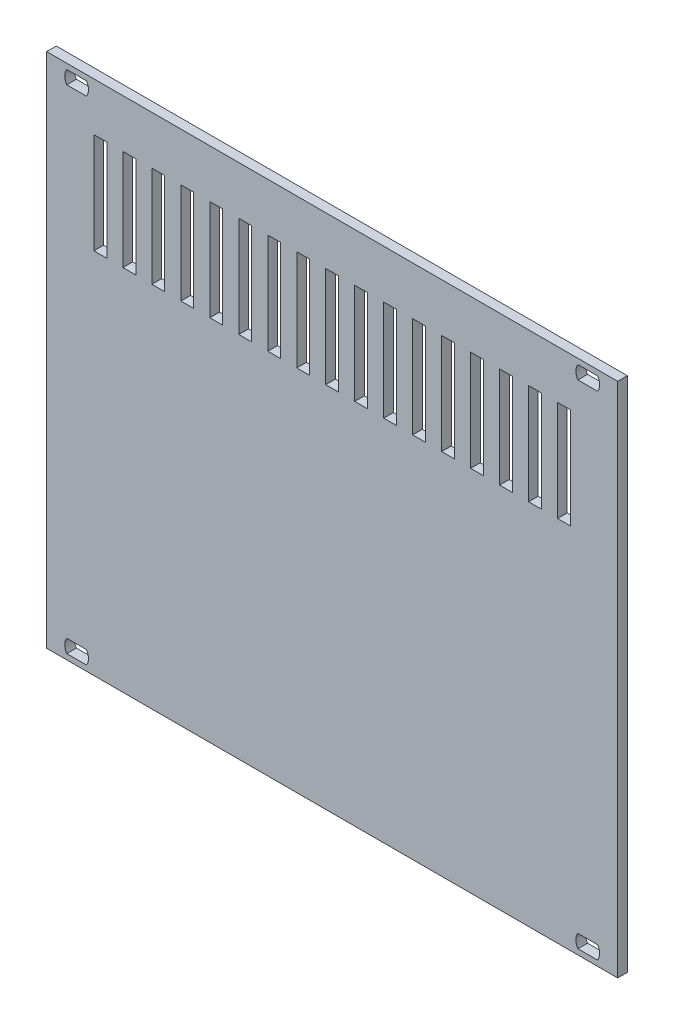
from build123d import *

# Parameters (mm, degrees)
MODEL_W            = 141.9
MODEL_H            = 128.4
MODEL_W_2          = 3.2
MODEL_H_2          = 25
BOSS_EXTRU_1_DEPTH = 2.4


with BuildPart() as part:
    # Model → Boss.-Extru.1 (new body)
    with BuildSketch(Plane.XY):
        with Locations((70.95, 64.2)):
            Rectangle(MODEL_W, MODEL_H)
        with BuildLine():
            Line((9.895405778, 123.750002855), (5.004594222, 123.750002855))
            ThreePointArc((5.004594222, 123.750002855), (4.5, 125.40000351), (5.004598148, 127.050002965))
            Line((5.004598148, 127.050002965), (9.895401852, 127.050002965))
            ThreePointArc((9.895401852, 127.050002965), (10.4, 125.40000351), (9.895405778, 123.750002855))
        make_face(mode=Mode.SUBTRACT)
        with BuildLine():
            Line((9.895410076, 1.350004659), (5.004596084, 1.350004659))
            ThreePointArc((5.004596084, 1.350004659), (4.50000308, 3.000002686), (5.004599089, 4.649999794))
            Line((5.004599089, 4.649999794), (9.895407071, 4.649999794))
            ThreePointArc((9.895407071, 4.649999794), (10.40000308, 3.000002686), (9.895410076, 1.350004659))
        make_face(mode=Mode.SUBTRACT)
        with BuildLine():
            Line((136.895403815, 123.749999945), (132.004596185, 123.749999945))
            ThreePointArc((132.004596185, 123.749999945), (131.5, 125.4), (132.004596185, 127.050000055))
            Line((132.004596185, 127.050000055), (136.895403815, 127.050000055))
            ThreePointArc((136.895403815, 127.050000055), (137.4, 125.4), (136.895403815, 123.749999945))
        make_face(mode=Mode.SUBTRACT)
        with BuildLine():
            Line((136.895406895, 1.349999945), (132.004599265, 1.349999945))
            ThreePointArc((132.004599265, 1.349999945), (131.50000308, 3), (132.004599265, 4.650000055))
            Line((132.004599265, 4.650000055), (136.895406895, 4.650000055))
            ThreePointArc((136.895406895, 4.650000055), (137.40000308, 3), (136.895406895, 1.349999945))
        make_face(mode=Mode.SUBTRACT)
        with Locations((13.35, 103.9)):
            Rectangle(MODEL_W_2, MODEL_H_2, mode=Mode.SUBTRACT)
        with Locations((20.55, 103.9)):
            Rectangle(MODEL_W_2, MODEL_H_2, mode=Mode.SUBTRACT)
        with Locations((27.75, 103.9)):
            Rectangle(MODEL_W_2, MODEL_H_2, mode=Mode.SUBTRACT)
        with Locations((34.95, 103.9)):
            Rectangle(MODEL_W_2, MODEL_H_2, mode=Mode.SUBTRACT)
        with Locations((42.15, 103.9)):
            Rectangle(MODEL_W_2, MODEL_H_2, mode=Mode.SUBTRACT)
        with Locations((49.35, 103.9)):
            Rectangle(MODEL_W_2, MODEL_H_2, mode=Mode.SUBTRACT)
        with Locations((56.55, 103.9)):
            Rectangle(MODEL_W_2, MODEL_H_2, mode=Mode.SUBTRACT)
        with Locations((63.75, 103.9)):
            Rectangle(MODEL_W_2, MODEL_H_2, mode=Mode.SUBTRACT)
        with Locations((70.95, 103.9)):
            Rectangle(MODEL_W_2, MODEL_H_2, mode=Mode.SUBTRACT)
        with Locations((78.15, 103.9)):
            Rectangle(MODEL_W_2, MODEL_H_2, mode=Mode.SUBTRACT)
        with Locations((85.35, 103.9)):
            Rectangle(MODEL_W_2, MODEL_H_2, mode=Mode.SUBTRACT)
        with Locations((92.55, 103.9)):
            Rectangle(MODEL_W_2, MODEL_H_2, mode=Mode.SUBTRACT)
        with Locations((99.75, 103.9)):
            Rectangle(MODEL_W_2, MODEL_H_2, mode=Mode.SUBTRACT)
        with Locations((106.95, 103.9)):
            Rectangle(MODEL_W_2, MODEL_H_2, mode=Mode.SUBTRACT)
        with Locations((114.15, 103.9)):
            Rectangle(MODEL_W_2, MODEL_H_2, mode=Mode.SUBTRACT)
        with Locations((121.35, 103.9)):
            Rectangle(MODEL_W_2, MODEL_H_2, mode=Mode.SUBTRACT)
        with Locations((128.55, 103.9)):
            Rectangle(MODEL_W_2, MODEL_H_2, mode=Mode.SUBTRACT)
    extrude(amount=BOSS_EXTRU_1_DEPTH)


solid = part.part
